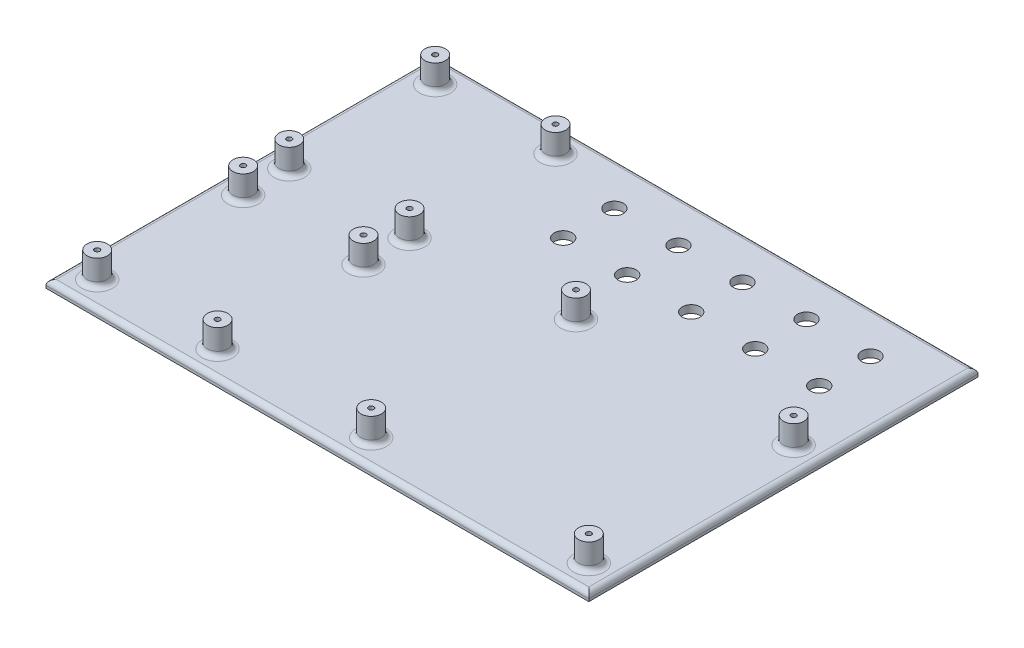
from build123d import *

# Parameters (mm, degrees)
SKETCH1_R               = 4
BOSS_EXTRUDE1_DEPTH     = 10
BOSS_EXTRUDE1_2_DEPTH   = 10
BOSS_EXTRUDE1_3_DEPTH   = 10
BOSS_EXTRUDE1_4_DEPTH   = 10
BOSS_EXTRUDE1_5_DEPTH   = 10
BOSS_EXTRUDE1_6_DEPTH   = 10
BOSS_EXTRUDE1_7_DEPTH   = 10
BOSS_EXTRUDE1_8_DEPTH   = 10
BOSS_EXTRUDE1_9_DEPTH   = 10
BOSS_EXTRUDE1_10_DEPTH  = 10
BOSS_EXTRUDE1_11_DEPTH  = 10
BOSS_EXTRUDE1_12_DEPTH  = 10
SKETCH2_W               = 212
SKETCH2_H               = 152
BOSS_EXTRUDE2_DEPTH     = 3
FILLET1_R               = 2
CUT_EXTRUDE1_DEPTH      = 185.263398427
CUT_EXTRUDE1_DEPTH_BACK = 185.263398427
SKETCH3_R               = 3.5
F_2_0MM_DOWEL_HOLE1_D   = 2


with BuildPart() as part:
    # Sketch1 → Boss-Extrude1 (new body)
    with BuildSketch(Plane(origin=(0, 0, 0), x_dir=(1, 0, 0), z_dir=(0, 1, 0))):
        with Locations(Location((0, 0, 0), (0, 0, 270))):
            Circle(SKETCH1_R)
    extrude(amount=BOSS_EXTRUDE1_DEPTH)



with BuildPart() as body_2:
    # Sketch1 → Boss-Extrude1 2 (new body)
    with BuildSketch(Plane(origin=(0, 0, 0), x_dir=(1, 0, 0), z_dir=(0, 1, 0))):
        with Locations(Location((0, 80, 0), (0, 0, 270))):
            Circle(SKETCH1_R)
    extrude(amount=BOSS_EXTRUDE1_2_DEPTH)


with BuildPart() as body_3:
    # Sketch1 → Boss-Extrude1 3 (new body)
    with BuildSketch(Plane(origin=(0, 0, 0), x_dir=(1, 0, 0), z_dir=(0, 1, 0))):
        with Locations(Location((85, 80, 0), (0, 0, 270))):
            Circle(SKETCH1_R)
    extrude(amount=BOSS_EXTRUDE1_3_DEPTH)


with BuildPart() as body_4:
    # Sketch1 → Boss-Extrude1 4 (new body)
    with BuildSketch(Plane(origin=(0, 0, 0), x_dir=(1, 0, 0), z_dir=(0, 1, 0))):
        with Locations(Location((85, 0, 0), (0, 0, 270))):
            Circle(SKETCH1_R)
    extrude(amount=BOSS_EXTRUDE1_4_DEPTH)


with BuildPart() as body_5:
    # Sketch1 → Boss-Extrude1 5 (new body)
    with BuildSketch(Plane(origin=(0, 0, 0), x_dir=(1, 0, 0), z_dir=(0, 1, 0))):
        with Locations(Location((-107, 0, 0), (0, 0, 270))):
            Circle(SKETCH1_R)
    extrude(amount=BOSS_EXTRUDE1_5_DEPTH)


with BuildPart() as body_6:
    # Sketch1 → Boss-Extrude1 6 (new body)
    with BuildSketch(Plane(origin=(0, 0, 0), x_dir=(1, 0, 0), z_dir=(0, 1, 0))):
        with Locations(Location((-60, 0, 0), (0, 0, 270))):
            Circle(SKETCH1_R)
    extrude(amount=BOSS_EXTRUDE1_6_DEPTH)


with BuildPart() as body_7:
    # Sketch1 → Boss-Extrude1 7 (new body)
    with BuildSketch(Plane(origin=(0, 0, 0), x_dir=(1, 0, 0), z_dir=(0, 1, 0))):
        with Locations(Location((-60, 57, 0), (0, 0, 270))):
            Circle(SKETCH1_R)
    extrude(amount=BOSS_EXTRUDE1_7_DEPTH)


with BuildPart() as body_8:
    # Sketch1 → Boss-Extrude1 8 (new body)
    with BuildSketch(Plane(origin=(0, 0, 0), x_dir=(1, 0, 0), z_dir=(0, 1, 0))):
        with Locations(Location((-107, 57, 0), (0, 0, 270))):
            Circle(SKETCH1_R)
    extrude(amount=BOSS_EXTRUDE1_8_DEPTH)


with BuildPart() as body_9:
    # Sketch1 → Boss-Extrude1 9 (new body)
    with BuildSketch(Plane(origin=(0, 0, 0), x_dir=(1, 0, 0), z_dir=(0, 1, 0))):
        with Locations(Location((-107, 132, 0), (0, 0, 270))):
            Circle(SKETCH1_R)
    extrude(amount=BOSS_EXTRUDE1_9_DEPTH)


with BuildPart() as body_10:
    # Sketch1 → Boss-Extrude1 10 (new body)
    with BuildSketch(Plane(origin=(0, 0, 0), x_dir=(1, 0, 0), z_dir=(0, 1, 0))):
        with Locations(Location((-60, 132, 0), (0, 0, 270))):
            Circle(SKETCH1_R)
    extrude(amount=BOSS_EXTRUDE1_10_DEPTH)


with BuildPart() as body_11:
    # Sketch1 → Boss-Extrude1 11 (new body)
    with BuildSketch(Plane(origin=(0, 0, 0), x_dir=(1, 0, 0), z_dir=(0, 1, 0))):
        with Locations(Location((-60, 75, 0), (0, 0, 270))):
            Circle(SKETCH1_R)
    extrude(amount=BOSS_EXTRUDE1_11_DEPTH)


with BuildPart() as body_12:
    # Sketch1 → Boss-Extrude1 12 (new body)
    with BuildSketch(Plane(origin=(0, 0, 0), x_dir=(1, 0, 0), z_dir=(0, 1, 0))):
        with Locations(Location((-107, 75, 0), (0, 0, 270))):
            Circle(SKETCH1_R)
    extrude(amount=BOSS_EXTRUDE1_12_DEPTH)


with BuildPart() as part_1:
    add(part.part)

    add(body_2.part)  # Boss-Extrude2 merges body 2

    add(body_3.part)  # Boss-Extrude2 merges body 3

    add(body_4.part)  # Boss-Extrude2 merges body 4

    add(body_5.part)  # Boss-Extrude2 merges body 5

    add(body_6.part)  # Boss-Extrude2 merges body 6

    add(body_7.part)  # Boss-Extrude2 merges body 7

    add(body_8.part)  # Boss-Extrude2 merges body 8

    add(body_9.part)  # Boss-Extrude2 merges body 9

    add(body_10.part)  # Boss-Extrude2 merges body 10

    add(body_11.part)  # Boss-Extrude2 merges body 11

    add(body_12.part)  # Boss-Extrude2 merges body 12
    # Sketch2 → Boss-Extrude2 (add)
    with BuildSketch(Plane(origin=(0, 0, 0), x_dir=(1, 0, 0), z_dir=(0, 1, 0))):
        with Locations((-11, 66)):
            Rectangle(SKETCH2_W, SKETCH2_H)
    extrude(amount=-BOSS_EXTRUDE2_DEPTH)

    # Fillet1
    fillet1_edges = [part_1.edges().sort_by_distance(p)[0] for p in [
        (0, 0, -84),
        (85, 0, -84),
        (85, 0, -4),
        (-60, 0, -4),
        (-60, 0, -61),
        (-107, 0, -4),
        (-107, 0, -61),
        (-60, 0, -79),
        (-60, 0, -136),
        (-107, 0, -79),
        (-107, 0, -136),
        (0, 0, -4),
        (-117, 0, -66),
        (-11, 0, 10),
        (95, 0, -66),
        (-11, 0, -142),
    ]]
    fillet(fillet1_edges, radius=FILLET1_R)

    # Sketch3 → Cut-Extrude1 (cut, two sides: drawn at the far end of the back side and taken through both)
    with BuildSketch(Plane(origin=(0, 0, 0), x_dir=(1, 0, 0), z_dir=(0, 1, 0)).offset(-CUT_EXTRUDE1_DEPTH_BACK)):
        with Locations(Location((-30, 125, 0), (0, 0, 270))):
            Circle(SKETCH3_R)
        with Locations(Location((-30, 105, 0), (0, 0, 270))):
            Circle(SKETCH3_R)
        with Locations(Location((-5, 105, 0), (0, 0, 270))):
            Circle(SKETCH3_R)
        with Locations(Location((-5, 125, 0), (0, 0, 270))):
            Circle(SKETCH3_R)
        with Locations(Location((20, 105, 0), (0, 0, 270))):
            Circle(SKETCH3_R)
        with Locations(Location((20, 125, 0), (0, 0, 270))):
            Circle(SKETCH3_R)
        with Locations(Location((45, 105, 0), (0, 0, 270))):
            Circle(SKETCH3_R)
        with Locations(Location((45, 125, 0), (0, 0, 270))):
            Circle(SKETCH3_R)
        with Locations(Location((70, 105, 0), (0, 0, 270))):
            Circle(SKETCH3_R)
        with Locations(Location((70, 125, 0), (0, 0, 270))):
            Circle(SKETCH3_R)
    extrude(amount=CUT_EXTRUDE1_DEPTH + CUT_EXTRUDE1_DEPTH_BACK, mode=Mode.SUBTRACT)

    # Ø2.0mm Dowel Hole1 (through all)
    with Locations(Plane(origin=(0, 10, 0), x_dir=(1, 0, 0), z_dir=(0, 1, 0))):
        with Locations((-107, 132), (-60, 132), (-60, 75), (-107, 75), (-60, 57), (-107, 57), (-107, 0), (-60, 0), (0, 0), (85, 0), (85, 80), (0, 80)):
            Hole(F_2_0MM_DOWEL_HOLE1_D / 2)


solid = part_1.part
